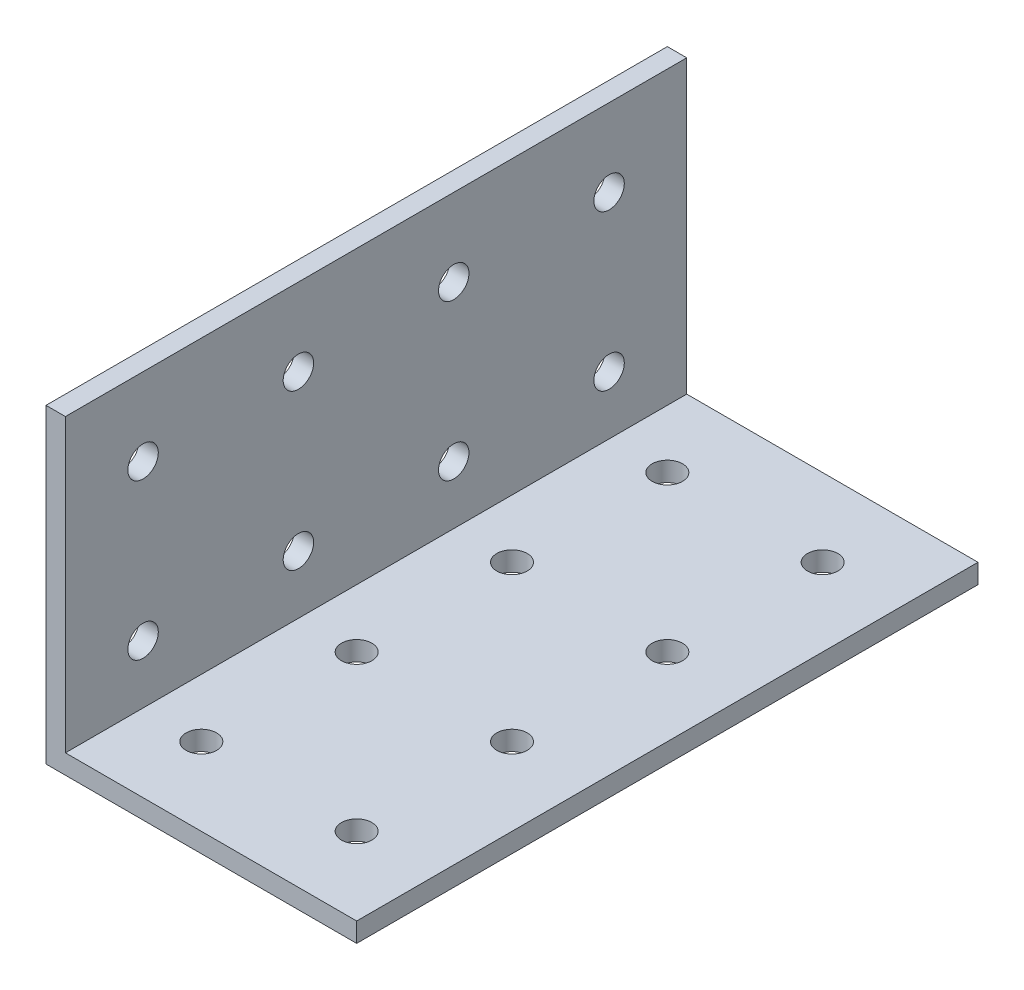
from build123d import *

# Parameters (mm, degrees)
SKETCH1_W           = 3.175
SKETCH1_H           = 47.625
SKETCH1_H_2         = 3.175
SKETCH1_W_2         = 47.625
BOSS_EXTRUDE1_DEPTH = 101.6
SKETCH2_R           = 2.4892
CUT_EXTRUDE1_DEPTH  = 101.6
SKETCH3_R           = 2.4892
CUT_EXTRUDE2_DEPTH  = 101.6


with BuildPart() as part:
    # Sketch1 → Boss-Extrude1 (new body)
    with BuildSketch(Plane.XY):
        with Locations((1.5875, 26.9875)):
            Rectangle(SKETCH1_W, SKETCH1_H)
        with Locations((1.5875, 1.5875)):
            Rectangle(SKETCH1_W, SKETCH1_H_2)
        with Locations((26.9875, 1.5875)):
            Rectangle(SKETCH1_W_2, SKETCH1_H_2)
    extrude(amount=BOSS_EXTRUDE1_DEPTH)

    # Sketch2 → Cut-Extrude1 (cut)
    with BuildSketch(Plane(origin=(0, 3.175, 0), x_dir=(1, 0, 0), z_dir=(0, 1, 0))):
        with Locations(Location((38.1, -12.7, 0), (0, 0, 270))):
            Circle(SKETCH2_R)
        with Locations(Location((12.7, -12.7, 0), (0, 0, 270))):
            Circle(SKETCH2_R)
        with Locations(Location((12.7, -38.1, 0), (0, 0, 270))):
            Circle(SKETCH2_R)
        with Locations(Location((12.7, -63.5, 0), (0, 0, 270))):
            Circle(SKETCH2_R)
        with Locations(Location((12.7, -88.9, 0), (0, 0, 270))):
            Circle(SKETCH2_R)
        with Locations(Location((38.1, -38.1, 0), (0, 0, 270))):
            Circle(SKETCH2_R)
        with Locations(Location((38.1, -63.5, 0), (0, 0, 270))):
            Circle(SKETCH2_R)
        with Locations(Location((38.1, -88.9, 0), (0, 0, 270))):
            Circle(SKETCH2_R)
    extrude(amount=-CUT_EXTRUDE1_DEPTH, mode=Mode.SUBTRACT)

    # Sketch3 → Cut-Extrude2 (cut)
    with BuildSketch(Plane(origin=(3.175, 0, 0), x_dir=(0, 0, -1), z_dir=(1, 0, 0))):
        with Locations((-88.9, 38.1)):
            Circle(SKETCH3_R)
        with Locations((-63.5, 38.1)):
            Circle(SKETCH3_R)
        with Locations((-38.1, 38.1)):
            Circle(SKETCH3_R)
        with Locations((-12.7, 38.1)):
            Circle(SKETCH3_R)
        with Locations((-63.5, 12.7)):
            Circle(SKETCH3_R)
        with Locations((-38.1, 12.7)):
            Circle(SKETCH3_R)
        with Locations((-12.7, 12.7)):
            Circle(SKETCH3_R)
        with Locations((-88.9, 12.7)):
            Circle(SKETCH3_R)
    extrude(amount=-CUT_EXTRUDE2_DEPTH, mode=Mode.SUBTRACT)


solid = part.part
